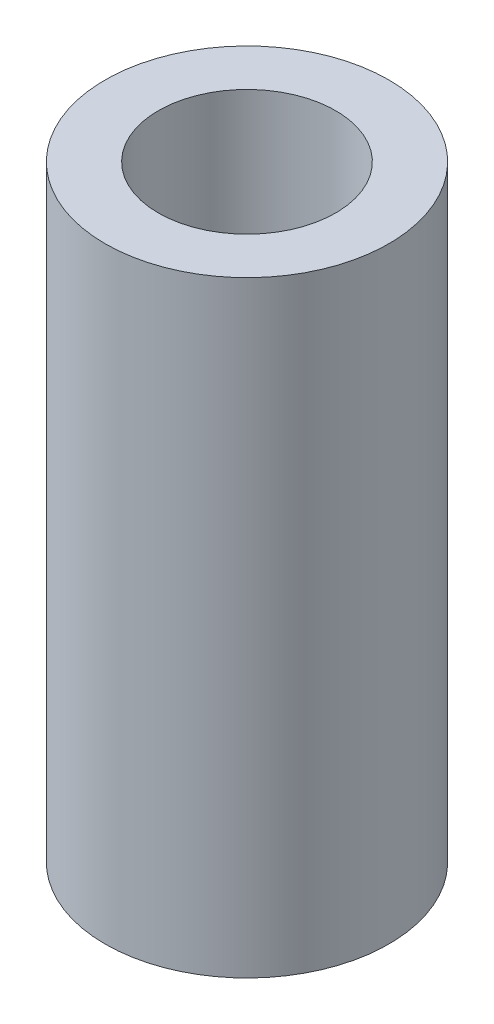
from build123d import *

# Parameters (mm, degrees)
SKETCH1_R           = 2
SKETCH1_R_2         = 1.25
BOSS_EXTRUDE1_DEPTH = 8.55


with BuildPart() as part:
    # Sketch1 → Boss-Extrude1 (new body)
    with BuildSketch(Plane(origin=(0, 0, 0), x_dir=(1, 0, 0), z_dir=(0, 1, 0))):
        with Locations(Location((0, 0, 0), (0, 0, 270))):
            Circle(SKETCH1_R)
        with Locations(Location((0, 0, 0), (0, 0, 270))):
            Circle(SKETCH1_R_2, mode=Mode.SUBTRACT)
    extrude(amount=BOSS_EXTRUDE1_DEPTH)


solid = part.part
